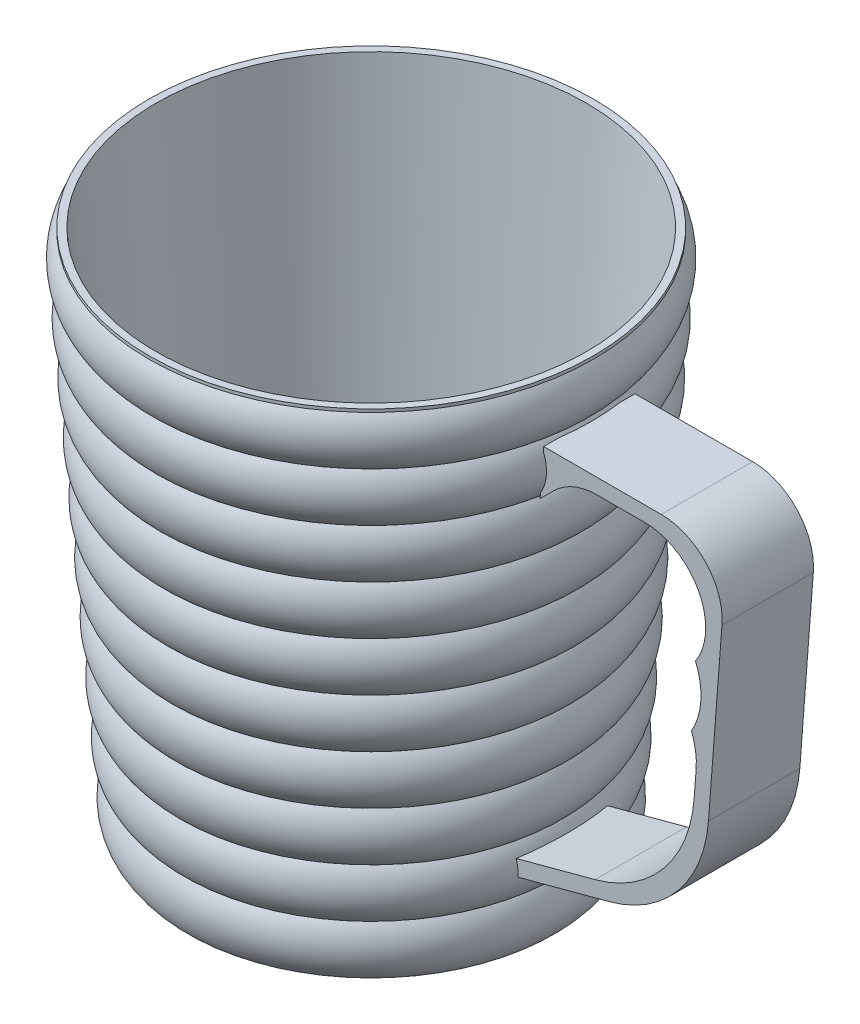
from build123d import *
from build123d.topology import SkipClean

# Parameters (mm, degrees)
BOSS_EXTRUDE1_DEPTH = 7.5


with BuildPart() as part:
    # Sketch1 → Revolve1 (revolve)
    with BuildSketch(Plane.XY, mode=Mode.PRIVATE) as revolve1_sk:
        with BuildLine():
            Line((0, 85), (36.5, 85))
            Line((36.5, 85), (30, 0))
            Line((30, 0), (27, 0))
            Line((27, 0), (27, 1))
            ThreePointArc((27, 1), (13.529966741, 2.349501108), (0, 2.8))
            Line((0, 2.8), (0, 85))
        make_face()
    revolve(revolve1_sk.sketch.rotate(Axis((0, 0, 0), (0, 1, 0)), 90), axis=Axis((0, 0, 0), (0, 1, 0)))

    # Sketch2 → Revolve2 (revolve)
    with BuildSketch(Plane.XY, mode=Mode.PRIVATE) as revolve2_sk:
        with BuildLine():
            Line((36.5, 85), (35.85, 76.5))
            ThreePointArc((35.85, 76.5), (37.670633329, 80.63562804), (36.5, 85))
        make_face()
        with BuildLine():
            Line((35.85, 76.5), (35.2, 68))
            ThreePointArc((35.2, 68), (37.020633329, 72.13562804), (35.85, 76.5))
        make_face()
        with BuildLine():
            Line((35.2, 68), (34.55, 59.5))
            ThreePointArc((34.55, 59.5), (36.370633329, 63.63562804), (35.2, 68))
        make_face()
        with BuildLine():
            Line((34.55, 59.5), (33.9, 51))
            ThreePointArc((33.9, 51), (35.720633329, 55.13562804), (34.55, 59.5))
        make_face()
        with BuildLine():
            Line((33.9, 51), (33.25, 42.5))
            ThreePointArc((33.25, 42.5), (35.070633329, 46.63562804), (33.9, 51))
        make_face()
        with BuildLine():
            Line((33.25, 42.5), (32.6, 34))
            ThreePointArc((32.6, 34), (34.420633329, 38.13562804), (33.25, 42.5))
        make_face()
        with BuildLine():
            Line((32.6, 34), (31.95, 25.5))
            ThreePointArc((31.95, 25.5), (33.770633329, 29.63562804), (32.6, 34))
        make_face()
        with BuildLine():
            Line((31.95, 25.5), (31.3, 17))
            ThreePointArc((31.3, 17), (33.120633329, 21.13562804), (31.95, 25.5))
        make_face()
        with BuildLine():
            Line((31.3, 17), (30.65, 8.5))
            ThreePointArc((30.65, 8.5), (32.470633329, 12.63562804), (31.3, 17))
        make_face()
        with BuildLine():
            Line((30.65, 8.5), (30, 0))
            ThreePointArc((30, 0), (31.820633329, 4.13562804), (30.65, 8.5))
        make_face()
    revolve(revolve2_sk.sketch.rotate(Axis((0, 0, 0), (0, 1, 0)), 90), axis=Axis((0, 0, 0), (0, 1, 0)))

    # Sketch3 → Boss-Extrude1 (add, symmetric)
    with BuildSketch(Plane.XY):
        with BuildLine():
            Line((30.955882353, 12.5), (31.15794307, 15.142332457))
            Line((31.15794307, 15.142332457), (44.261543917, 18.653431722))
            ThreePointArc((44.261543917, 18.653431722), (55.497634226, 25.854906739), (60.503480416, 38.22634448))
            Line((60.503480416, 38.22634448), (60.839706591, 42.623148303))
            ThreePointArc((60.839706591, 42.623148303), (60.745283765, 45.210367237), (60.074506822, 47.710902334))
            ThreePointArc((60.074506822, 47.710902334), (61.614064422, 52.76011679), (60.735615628, 57.965223124))
            ThreePointArc((60.735615628, 57.965223124), (61.220254453, 68.225051917), (52.406975587, 73.5))
            Line((52.406975587, 73.5), (44.5650768, 73.5))
            ThreePointArc((44.5650768, 73.5), (40.738242477, 72.738795325), (37.494008988, 70.571067812))
            Line((37.494008988, 70.571067812), (35.222941176, 68.3))
            Line((35.222941176, 68.3), (35.811764706, 76))
            Line((35.811764706, 76), (55.105451091, 76))
            ThreePointArc((55.105451091, 76), (62.44114456, 72.796146064), (65.07633995, 65.237520264))
            Line((65.07633995, 65.237520264), (62.861168581, 36.269894669))
            ThreePointArc((62.861168581, 36.269894669), (57.855322391, 23.898456928), (46.619232082, 16.696981911))
            Line((46.619232082, 16.696981911), (30.955882353, 12.5))
        make_face()
    extrude(amount=BOSS_EXTRUDE1_DEPTH, both=True)

    # Sketch4 → Cut-Revolve1 (revolve, cut)
    with BuildSketch(Plane.XY, mode=Mode.PRIVATE) as cut_revolve1_sk:
        Polygon((35.296496464, 85), (29.102378817, 4), (0, 4), (0, 85), align=None)
    revolve(cut_revolve1_sk.sketch.rotate(Axis((0, 0, 0), (0, 1, 0)), 180), axis=Axis((0, 0, 0), (0, 1, 0)), mode=Mode.SUBTRACT)

    # Sketch5 → Revolve3 (revolve)
    with SkipClean():  # the faces are left unmerged after this step: merging them gives an invalid solid
        with BuildSketch(Plane.XY, mode=Mode.PRIVATE) as revolve3_sk:
            Polygon((35.296496464, 85), (36.5, 85), (36.5, 85.5), (35.334731758, 85.5), align=None)
        revolve(revolve3_sk.sketch.rotate(Axis((0, 0, 0), (0, 1, 0)), 90), axis=Axis((0, 0, 0), (0, 1, 0)))


solid = part.part
